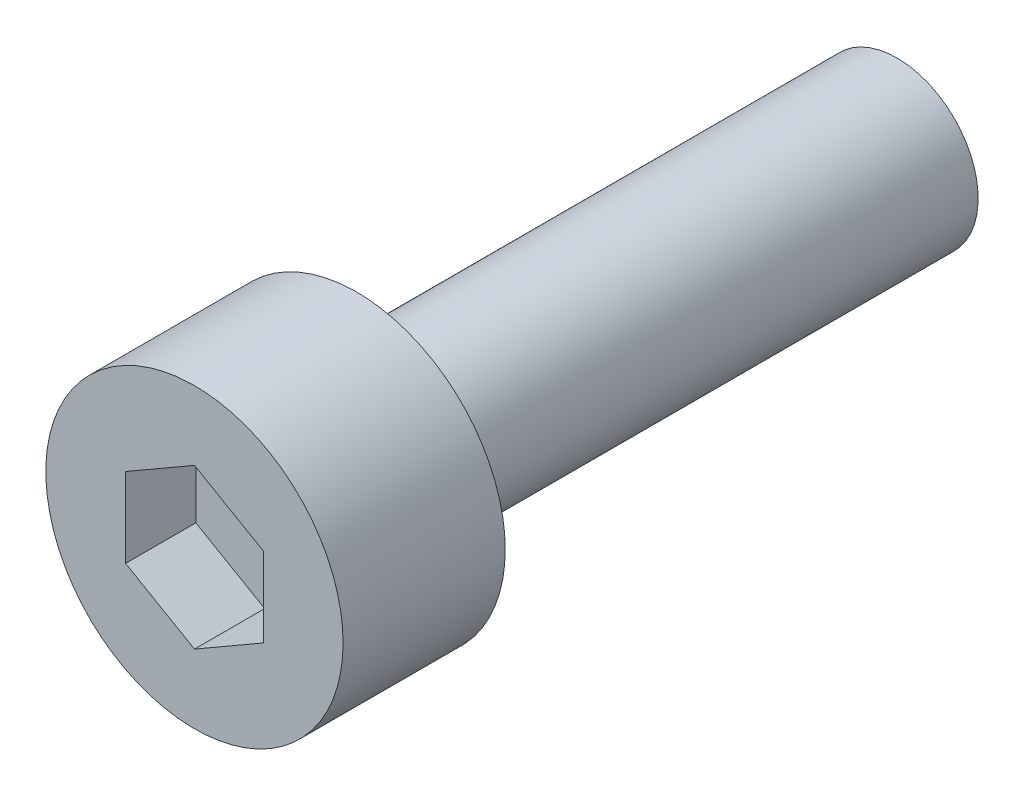
from build123d import *

# Parameters (mm, degrees)
SKETCH_1_R          = 2.75
EXTRUDE_1_DEPTH     = 3
CUT_EXTRUDE_1_DEPTH = 1.3
SKETCH_3_R          = 1.5
EXTRUDE_2_DEPTH     = 10


with BuildPart() as part:
    # 草图1 → 凸台-拉伸1 (new body)
    with BuildSketch(Plane.XY):
        Circle(SKETCH_1_R)
    extrude(amount=EXTRUDE_1_DEPTH)

    # 草图2 → 切除-拉伸1 (cut)
    with BuildSketch(Plane.XY.offset(3)):
        Polygon((1.275, -0.736121593), (1.275, 0.736121593), (0, 1.472243186), (-1.275, 0.736121593), (-1.275, -0.736121593), (0, -1.472243186), align=None)
    extrude(amount=-CUT_EXTRUDE_1_DEPTH, mode=Mode.SUBTRACT)

    # 草图3 → 凸台-拉伸2 (add)
    with BuildSketch(Plane(origin=(0, 0, 0), x_dir=(-1, 0, 0), z_dir=(0, 0, -1))):
        Circle(SKETCH_3_R)
    extrude(amount=EXTRUDE_2_DEPTH)


solid = part.part
